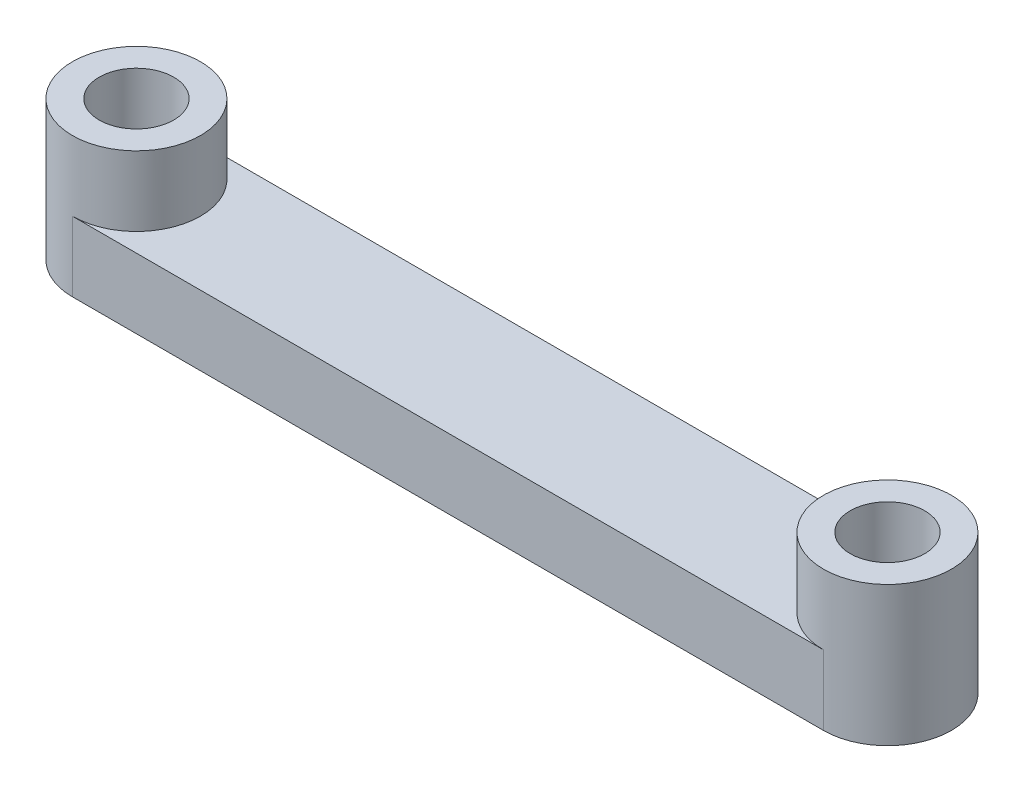
from build123d import *

# Parameters (mm, degrees)
CROQUIS1_R              = 1.6
SALIENTE_EXTRUIR1_DEPTH = 3
CROQUIS2_R              = 2.75
CROQUIS2_R_2            = 1.6
SALIENTE_EXTRUIR2_DEPTH = 3


with BuildPart() as part:
    # Croquis1 → Saliente-Extruir1 (new body)
    with BuildSketch(Plane(origin=(0, 0, 0), x_dir=(1, 0, 0), z_dir=(0, 1, 0))):
        with BuildLine():
            ThreePointArc((0, 2.75), (-2.75, 0), (0, -2.75))
            Line((0, -2.75), (32.26, -2.75))
            ThreePointArc((32.26, -2.75), (35.01, 0), (32.26, 2.75))
            Line((32.26, 2.75), (0, 2.75))
        make_face()
        with Locations(Location((0, 0, 0), (0, 0, 270))):
            Circle(CROQUIS1_R, mode=Mode.SUBTRACT)
        with Locations(Location((32.26, 0, 0), (0, 0, 270))):
            Circle(CROQUIS1_R, mode=Mode.SUBTRACT)
    extrude(amount=SALIENTE_EXTRUIR1_DEPTH)

    # Croquis2 → Saliente-Extruir2 (add)
    # profile 1 of 2: a face of its own
    with BuildSketch(Plane(origin=(0, 3, 0), x_dir=(1, 0, 0), z_dir=(0, 1, 0))):
        with Locations(Location((0, 0, 0), (0, 0, 270))):
            Circle(CROQUIS2_R)
        with Locations(Location((0, 0, 0), (0, 0, 270))):
            Circle(CROQUIS2_R_2, mode=Mode.SUBTRACT)
    # profile 2 of 2: a face of its own
    with BuildSketch(Plane(origin=(0, 3, 0), x_dir=(1, 0, 0), z_dir=(0, 1, 0))):
        with Locations(Location((32.26, 0, 0), (0, 0, 270))):
            Circle(CROQUIS2_R)
        with Locations(Location((32.26, 0, 0), (0, 0, 270))):
            Circle(CROQUIS2_R_2, mode=Mode.SUBTRACT)
    extrude(amount=SALIENTE_EXTRUIR2_DEPTH)


solid = part.part
